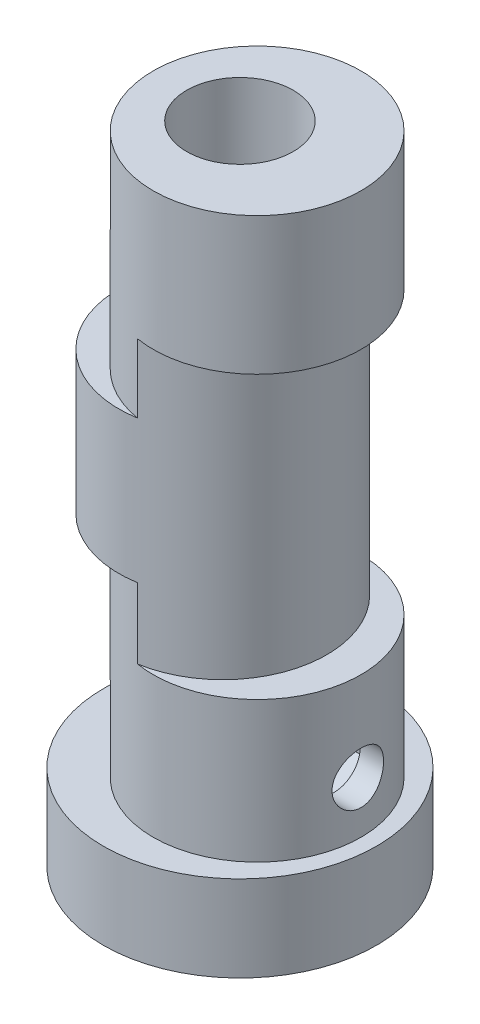
from build123d import *

# Parameters (mm, degrees)
SKETCH1_R           = 7.95
BOSS_EXTRUDE1_DEPTH = 5
SKETCH2_R           = 6.05
BOSS_EXTRUDE2_DEPTH = 8.2
SKETCH3_R           = 6.05
BOSS_EXTRUDE3_DEPTH = 16.4
CUT_EXTRUDE1_DEPTH  = 4.1
SKETCH5_R           = 6.05
BOSS_EXTRUDE4_DEPTH = 8
CUT_EXTRUDE2_START  = -4
CUT_EXTRUDE2_DEPTH  = 4
SKETCH7_R           = 3.1
CUT_EXTRUDE3_DEPTH  = 40.244935979
SKETCH8_R           = 1.5
CUT_EXTRUDE4_DEPTH  = 40.244935979
SKETCH9_R           = 1.5
CUT_EXTRUDE5_DEPTH  = 5.5


with BuildPart() as part:
    # Sketch1 → Boss-Extrude1 (new body)
    with BuildSketch(Plane(origin=(0, 0, 0), x_dir=(1, 0, 0), z_dir=(0, 1, 0))):
        with Locations(Location((0, 0, 0), (0, 0, 270))):
            Circle(SKETCH1_R)
    extrude(amount=BOSS_EXTRUDE1_DEPTH)

    # Sketch2 → Boss-Extrude2 (add)
    with BuildSketch(Plane(origin=(0, 5, 0), x_dir=(1, 0, 0), z_dir=(0, 1, 0))):
        with Locations(Location((1, 0, 0), (0, 0, 270))):
            Circle(SKETCH2_R)
    extrude(amount=BOSS_EXTRUDE2_DEPTH)

    # Sketch3 → Boss-Extrude3 (add)
    with BuildSketch(Plane(origin=(0, 13.2, 0), x_dir=(1, 0, 0), z_dir=(0, 1, 0))):
        with Locations(Location((-1, 0, 0), (0, 0, 80.485961644))):
            Circle(SKETCH3_R)
    extrude(amount=BOSS_EXTRUDE3_DEPTH)

    # Sketch4 → Cut-Extrude1 (cut)
    with BuildSketch(Plane.XZ.offset(-13.2)):
        with BuildLine():
            ThreePointArc((0, 5.966783053), (-7.05, 0), (0, -5.966783053))
            ThreePointArc((0, -5.966783053), (-5.05, 0), (0, 5.966783053))
        make_face()
    extrude(amount=-CUT_EXTRUDE1_DEPTH, mode=Mode.SUBTRACT)

    # Sketch5 → Boss-Extrude4 (add)
    with BuildSketch(Plane(origin=(0, 29.6, 0), x_dir=(1, 0, 0), z_dir=(0, 1, 0))):
        with Locations(Location((1, 0, 0), (0, 0, 99.514038356))):
            Circle(SKETCH5_R)
    extrude(amount=BOSS_EXTRUDE4_DEPTH)

    # Sketch6 → Cut-Extrude2 (cut)
    with BuildSketch(Plane(origin=(0, 29.6, 0), x_dir=(1, 0, 0), z_dir=(0, 1, 0)).offset(CUT_EXTRUDE2_START)):
        with BuildLine():
            ThreePointArc((0, 5.966783053), (-5.05, 0), (0, -5.966783053))
            ThreePointArc((0, -5.966783053), (-7.05, 0), (0, 5.966783053))
        make_face()
    extrude(amount=CUT_EXTRUDE2_DEPTH, mode=Mode.SUBTRACT)

    # Sketch7 → Cut-Extrude3 (cut, through all)
    with BuildSketch(Plane.XZ):
        with Locations(Location((0, 0, 0), (0, 0, 270))):
            Circle(SKETCH7_R)
    extrude(amount=-CUT_EXTRUDE3_DEPTH, mode=Mode.SUBTRACT)

    # Sketch8 → Cut-Extrude4 (cut, through all)
    with BuildSketch(Plane(origin=(0, 0, 0), x_dir=(0, 0, -1), z_dir=(1, 0, 0))):
        with Locations(Location((0, 8, 0), (0, 0, 180))):
            Circle(SKETCH8_R)
    extrude(amount=CUT_EXTRUDE4_DEPTH, mode=Mode.SUBTRACT)

    # Sketch9 → Cut-Extrude5 (cut)
    with BuildSketch(Plane(origin=(0, 0, 0), x_dir=(0, 0, -1), z_dir=(1, 0, 0))):
        Polygon((0, 11.175426481), (-2.75, 9.58771324), (-2.75, 6.41228676), (0, 4.824573519), (2.75, 6.41228676), (2.75, 9.58771324), align=None)
        with Locations(Location((0, 8, 0), (0, 0, 180))):
            Circle(SKETCH9_R, mode=Mode.SUBTRACT)
    extrude(amount=CUT_EXTRUDE5_DEPTH, mode=Mode.SUBTRACT)


solid = part.part
